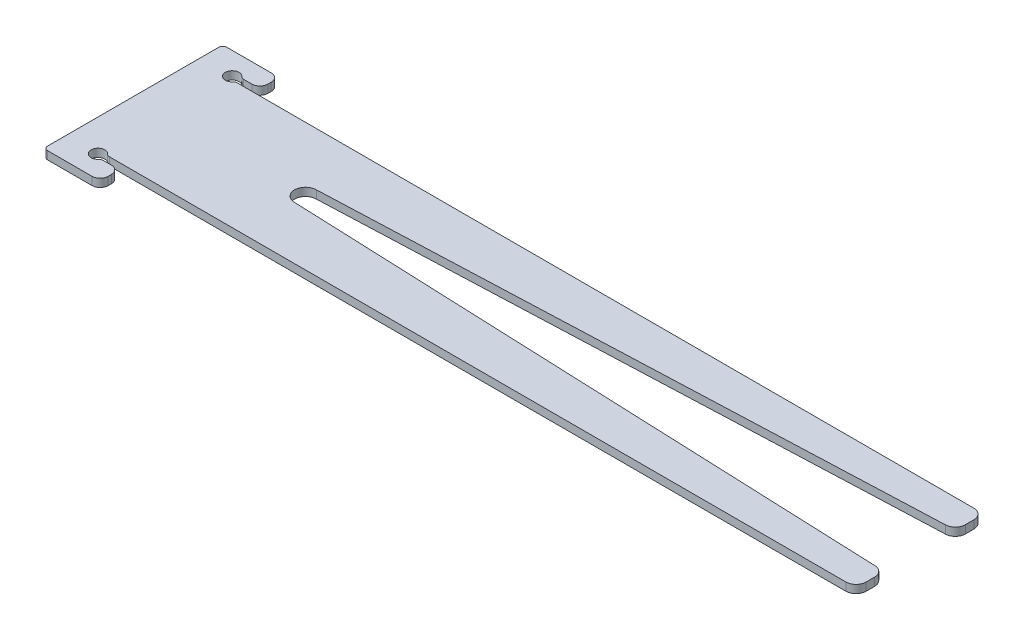
from build123d import *

# Parameters (mm, degrees)
BOSS_EXTRUDE1_DEPTH = 2
FILLET1_R           = 1
FILLET2_R           = 2
FILLET3_R           = 2.5


with BuildPart() as part:
    # Sketch1 → Boss-Extrude1 (new body)
    with BuildSketch(Plane(origin=(0, 0, 0), x_dir=(1, 0, 0), z_dir=(0, 1, 0))):
        with BuildLine():
            Line((-74.131846847, 10.311334612), (-69.544914922, 10.311334612))
            Line((-69.544914922, 10.311334612), (-69.544914922, 15.111334612))
            Line((-69.544914922, 15.111334612), (-83.544914922, 15.111334612))
            Line((-83.544914922, 15.111334612), (-83.544914922, -29.288665388))
            Line((-83.544914922, -29.288665388), (-69.544914922, -29.288665388))
            Line((-69.544914922, -29.288665388), (-69.544914922, -24.488665388))
            Line((-69.544914922, -24.488665388), (-74.131846847, -24.488665388))
            ThreePointArc((-74.131846847, -24.488665388), (-77.344914922, -23.713665388), (-74.131846847, -22.938665388))
            Line((-74.131846847, -22.938665388), (-69.544914922, -22.938665388))
            Line((-69.544914922, -22.938665388), (111.455085078, -22.938665388))
            Line((111.455085078, -22.938665388), (111.455085078, -15.938665388))
            Line((111.455085078, -15.938665388), (-40.844914922, -9.788665388))
            ThreePointArc((-40.844914922, -9.788665388), (-43.544914922, -7.088665388), (-40.844914922, -4.388665388))
            Line((-40.844914922, -4.388665388), (111.455085078, 1.761334612))
            Line((111.455085078, 1.761334612), (111.455085078, 8.761334612))
            Line((111.455085078, 8.761334612), (-69.544914922, 8.761334612))
            Line((-69.544914922, 8.761334612), (-74.131846847, 8.761334612))
            ThreePointArc((-74.131846847, 8.761334612), (-77.344914922, 9.536334612), (-74.131846847, 10.311334612))
        make_face()
    extrude(amount=BOSS_EXTRUDE1_DEPTH)

    # Fillet1
    fillet1_edges = [part.edges().sort_by_distance(p)[0] for p in [
        (-74.131846847, 1, 24.488665388),
        (-74.131846847, 1, 22.938665388),
        (-74.131846847, 1, -8.761334612),
        (-74.131846847, 1, -10.311334612),
        (-83.544914922, 1, -15.111334612),
        (-83.544914922, 1, 29.288665388),
    ]]
    fillet(fillet1_edges, radius=FILLET1_R)

    # Fillet2
    fillet2_edges = [part.edges().sort_by_distance(p)[0] for p in [
        (-69.544914922, 1, -15.111334612),
        (-69.544914922, 1, 29.288665388),
        (-69.544914922, 1, -10.311334612),
        (-69.544914922, 1, 24.488665388),
    ]]
    fillet(fillet2_edges, radius=FILLET2_R)

    # Fillet3
    fillet3_edges = [part.edges().sort_by_distance(p)[0] for p in [
        (111.455085078, 1, 22.938665388),
        (111.455085078, 1, 15.938665388),
        (111.455085078, 1, -8.761334612),
        (111.455085078, 1, -1.761334612),
    ]]
    fillet(fillet3_edges, radius=FILLET3_R)


solid = part.part
